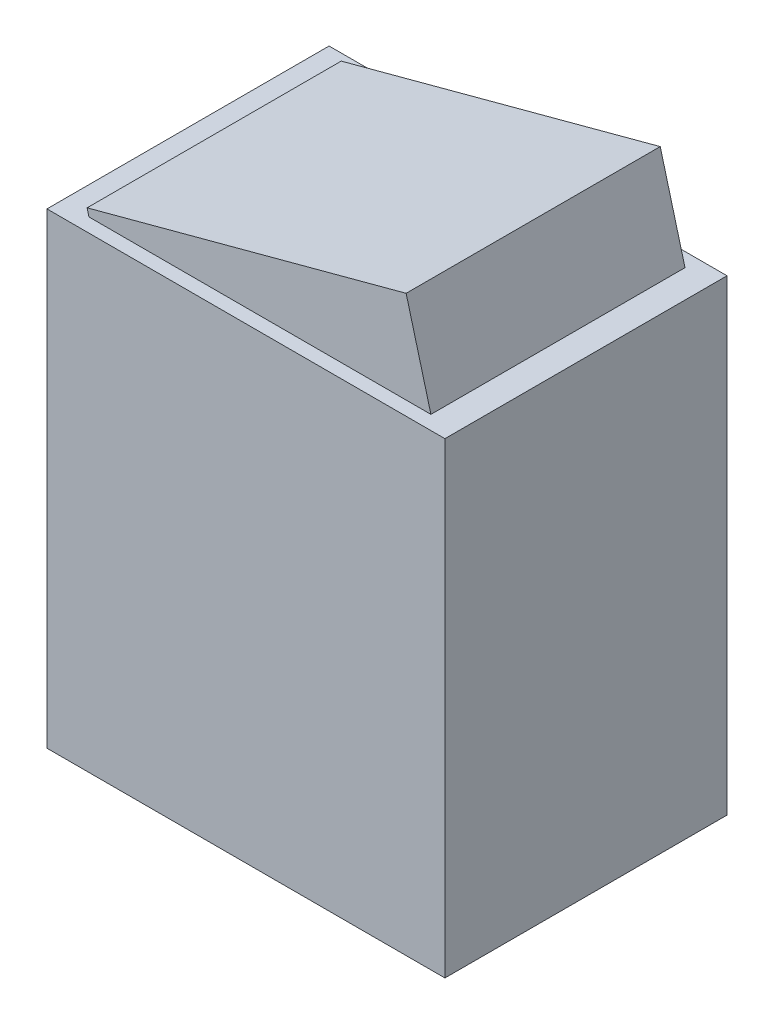
from build123d import *

# Parameters (mm, degrees)
SKETCH1_W           = 21.3
SKETCH1_H           = 15.1
BOSS_EXTRUDE1_DEPTH = 25
BOSS_EXTRUDE2_REACH = 34.289
SKETCH4_W           = 13.6
SKETCH4_H           = 17.676442621


with BuildPart() as part:
    # Sketch1 → Boss-Extrude1 (new body)
    with BuildSketch(Plane(origin=(0, 0, 0), x_dir=(1, 0, 0), z_dir=(0, 1, 0))):
        Rectangle(SKETCH1_W, SKETCH1_H)
    extrude(amount=BOSS_EXTRUDE1_DEPTH)

    # Boss-Extrude2: up to this plane
    boss_extrude2_end = Plane(origin=(0, 25, 0), z_dir=(0, 1, 0))
    # Sketch4 → Boss-Extrude2 (add, up to the surface)
    with BuildSketch(Plane(origin=(-6.963414725, 25.987817547, 0), x_dir=(0, 0, 1), z_dir=(-0.25881904510252474, 0.9659258262890673, 0)), mode=Mode.PRIVATE) as boss_extrude2_sk1:
        with Locations((0, 6.470476128)):
            Rectangle(SKETCH4_W, SKETCH4_H)
    boss_extrude2_tool1 = split(extrude(boss_extrude2_sk1.sketch, amount=-BOSS_EXTRUDE2_REACH, mode=Mode.PRIVATE), bisect_by=boss_extrude2_end, keep=Keep.BOTH, mode=Mode.PRIVATE)
    add(boss_extrude2_tool1.solids().sort_by_distance((-0.713415, 27.6625, 0))[0])


solid = part.part
